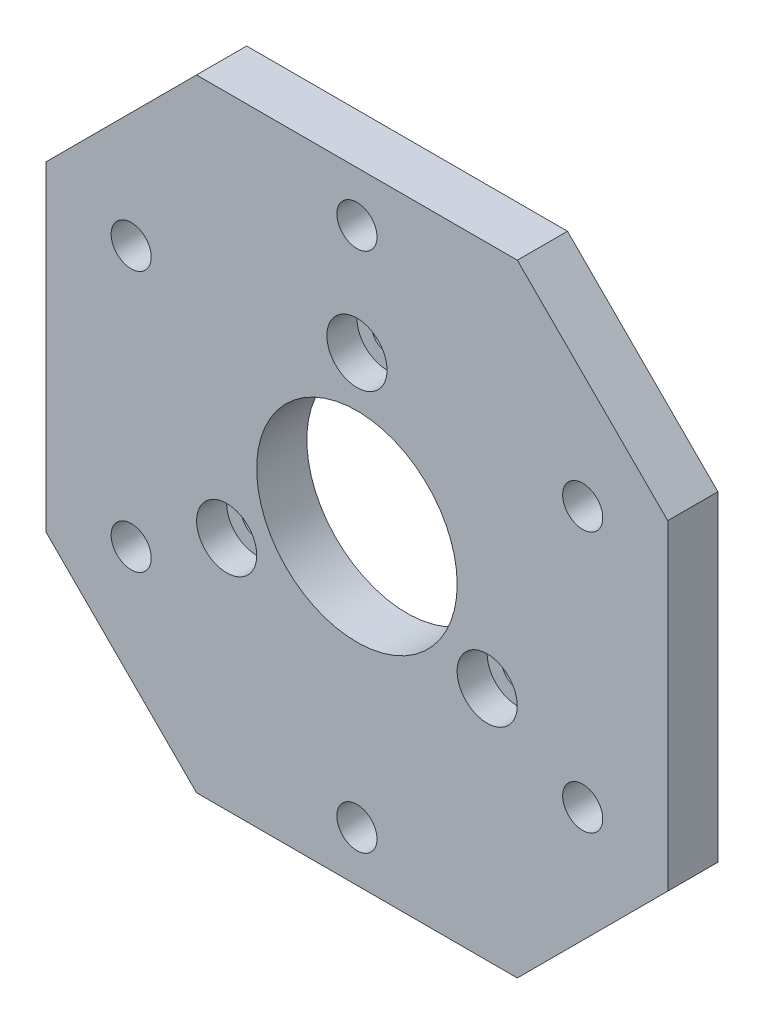
from build123d import *

# Parameters (mm, degrees)
SKETCH1_W           = 62
SKETCH1_H           = 62
SKETCH1_R           = 10
SKETCH1_R_2         = 2
SKETCH1_R_3         = 1.5
BOSS_EXTRUDE1_DEPTH = 5
CUT_EXTRUDE2_DEPTH  = 10
SKETCH4_R           = 3
CUT_EXTRUDE3_DEPTH  = 3


with BuildPart() as part:
    # Sketch1 → Boss-Extrude1 (new body)
    with BuildSketch(Plane.XY):
        Rectangle(SKETCH1_W, SKETCH1_H)
        Circle(SKETCH1_R, mode=Mode.SUBTRACT)
        with Locations((0, 26)):
            Circle(SKETCH1_R_2, mode=Mode.SUBTRACT)
        with Locations((0, 15)):
            Circle(SKETCH1_R_3, mode=Mode.SUBTRACT)
        with Locations((22.516660498, 13)):
            Circle(SKETCH1_R_2, mode=Mode.SUBTRACT)
        with Locations((22.516660498, -13)):
            Circle(SKETCH1_R_2, mode=Mode.SUBTRACT)
        with Locations((0, -26)):
            Circle(SKETCH1_R_2, mode=Mode.SUBTRACT)
        with Locations((-22.516660498, -13)):
            Circle(SKETCH1_R_2, mode=Mode.SUBTRACT)
        with Locations((-22.516660498, 13)):
            Circle(SKETCH1_R_2, mode=Mode.SUBTRACT)
        with Locations((12.990381057, -7.5)):
            Circle(SKETCH1_R_3, mode=Mode.SUBTRACT)
        with Locations((-12.990381057, -7.5)):
            Circle(SKETCH1_R_3, mode=Mode.SUBTRACT)
    extrude(amount=BOSS_EXTRUDE1_DEPTH)

    # Sketch3 → Cut-Extrude2 (cut)
    with BuildSketch(Plane(origin=(0, 0, 0), x_dir=(-1, 0, 0), z_dir=(0, 0, -1))):
        Polygon((-31, 31), (-31, 16), (-16, 31), align=None)
        Polygon((31, 31), (16, 31), (31, 16), align=None)
        Polygon((31, -31), (31, -16), (16, -31), align=None)
        Polygon((-31, -31), (-16, -31), (-31, -16), align=None)
    extrude(amount=-CUT_EXTRUDE2_DEPTH, mode=Mode.SUBTRACT)

    # Sketch4 → Cut-Extrude3 (cut)
    with BuildSketch(Plane.XY.offset(5)):
        with Locations((0, 15)):
            Circle(SKETCH4_R)
        with Locations((12.990381057, -7.5)):
            Circle(SKETCH4_R)
        with Locations((-12.990381057, -7.5)):
            Circle(SKETCH4_R)
    extrude(amount=-CUT_EXTRUDE3_DEPTH, mode=Mode.SUBTRACT)


solid = part.part
